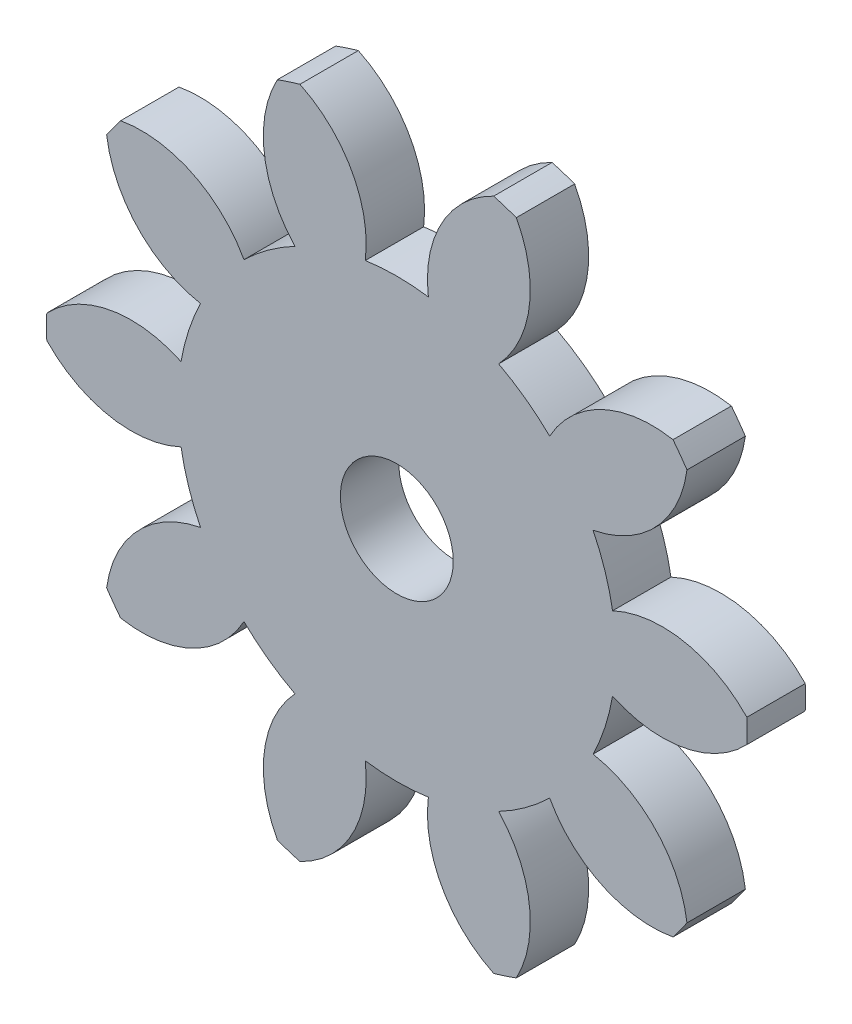
from build123d import *

# Parameters (mm, degrees)
SKETCH1_R           = 18
BOSS_EXTRUDE1_DEPTH = 3
CUT_EXTRUDE2_START  = -3
CUT_EXTRUDE2_DEPTH  = 3
CIRPATTERN1_COUNT   = 10
SKETCH5_R           = 2.9
CUT_EXTRUDE4_DEPTH  = 26.143875003


with BuildPart() as part:
    # Sketch1 → Boss-Extrude1 (new body)
    with BuildSketch(Plane.XY):
        Circle(SKETCH1_R)
    extrude(amount=BOSS_EXTRUDE1_DEPTH)

    # Sketch2 → Cut-Extrude2 (cut)
    with BuildSketch(Plane.XY.offset(3).offset(CUT_EXTRUDE2_START)):
        with BuildLine():
            ThreePointArc((-4.978508794, 17.297816342), (-2.304057127, 14.757459448), (-1.621139762, 11.132583073))
            ThreePointArc((-1.621139762, 11.132583073), (0, 11.25), (1.621139762, 11.132583073))
            ThreePointArc((1.621139762, 11.132583073), (2.304057127, 14.757459448), (4.978508794, 17.297816342))
            ThreePointArc((4.978508794, 17.297816342), (0, 18), (-4.978508794, 17.297816342))
        make_face()
    cut_extrude2 = extrude(amount=CUT_EXTRUDE2_DEPTH, mode=Mode.SUBTRACT)

    # CirPattern1: Cut-Extrude2 ×10 about axis
    cirpattern1_axis = Axis((0, 0, 0), (0, 0, 1))
    for i in range(1, CIRPATTERN1_COUNT):
        add(cut_extrude2.rotate(cirpattern1_axis, i * 360 / CIRPATTERN1_COUNT), mode=Mode.SUBTRACT)

    # Sketch5 → Cut-Extrude4 (cut, through all)
    with BuildSketch(Plane.XY.offset(3)):
        Circle(SKETCH5_R)
    extrude(amount=-CUT_EXTRUDE4_DEPTH, mode=Mode.SUBTRACT)


solid = part.part
